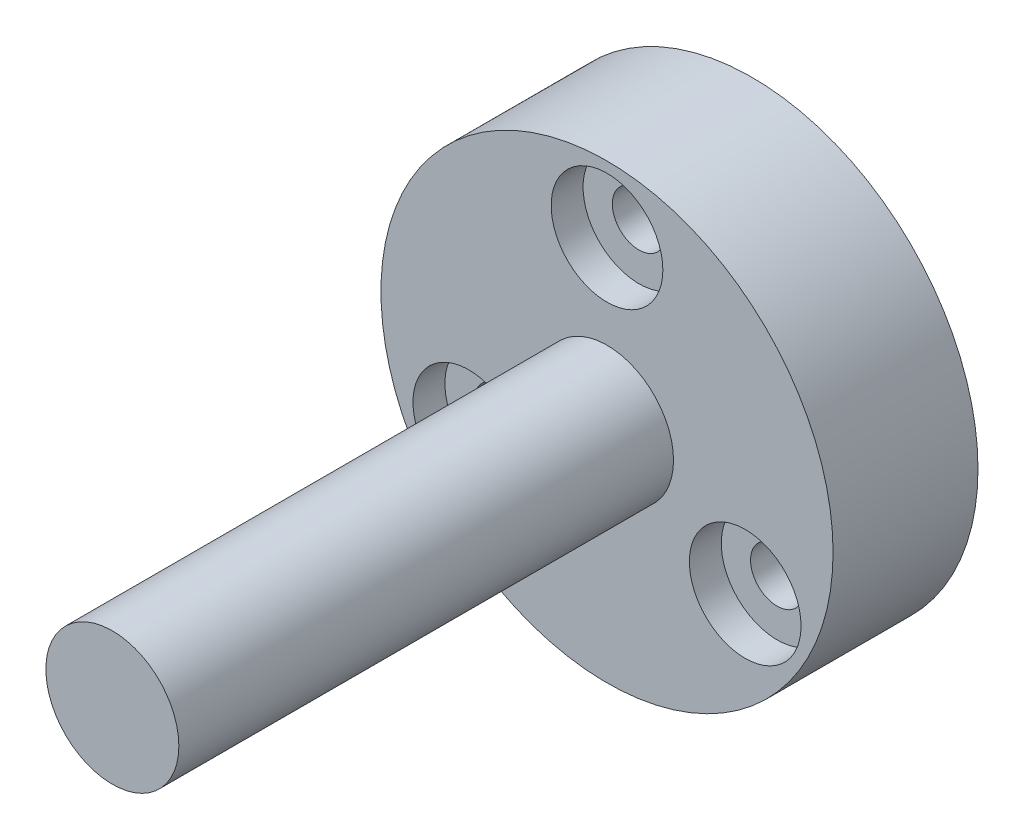
from build123d import *

# Parameters (mm, degrees)
SKETCH1_R           = 8.5
BOSS_EXTRUDE1_DEPTH = 5.45
SKETCH2_R           = 1
CUT_EXTRUDE1_DEPTH  = 5.45
SKETCH3_R           = 2.5
BOSS_EXTRUDE2_DEPTH = 18.6
SKETCH6_R           = 2.1
CUT_EXTRUDE2_DEPTH  = 1.2
SKETCH7_R           = 4.5
CUT_EXTRUDE3_DEPTH  = 2


with BuildPart() as part:
    # Sketch1 → Boss-Extrude1 (new body)
    with BuildSketch(Plane.XY):
        Circle(SKETCH1_R)
    extrude(amount=BOSS_EXTRUDE1_DEPTH)

    # Sketch2 → Cut-Extrude1 (cut)
    with BuildSketch(Plane.XY.offset(5.45)):
        with Locations((0, 6)):
            Circle(SKETCH2_R)
        with Locations((5.196152423, -3)):
            Circle(SKETCH2_R)
        with Locations((-5.196152423, -3)):
            Circle(SKETCH2_R)
    extrude(amount=-CUT_EXTRUDE1_DEPTH, mode=Mode.SUBTRACT)

    # Sketch3 → Boss-Extrude2 (add)
    with BuildSketch(Plane.XY.offset(5.45)):
        Circle(SKETCH3_R)
    extrude(amount=BOSS_EXTRUDE2_DEPTH)

    # Sketch6 → Cut-Extrude2 (cut)
    with BuildSketch(Plane.XY.offset(5.45)):
        with Locations((5.196152423, -3)):
            Circle(SKETCH6_R)
        with Locations((0, 6)):
            Circle(SKETCH6_R)
        with Locations((-5.196152423, -3)):
            Circle(SKETCH6_R)
    extrude(amount=-CUT_EXTRUDE2_DEPTH, mode=Mode.SUBTRACT)

    # Sketch7 → Cut-Extrude3 (cut)
    with BuildSketch(Plane(origin=(0, 0, 0), x_dir=(-1, 0, 0), z_dir=(0, 0, -1))):
        Circle(SKETCH7_R)
    extrude(amount=-CUT_EXTRUDE3_DEPTH, mode=Mode.SUBTRACT)


solid = part.part
